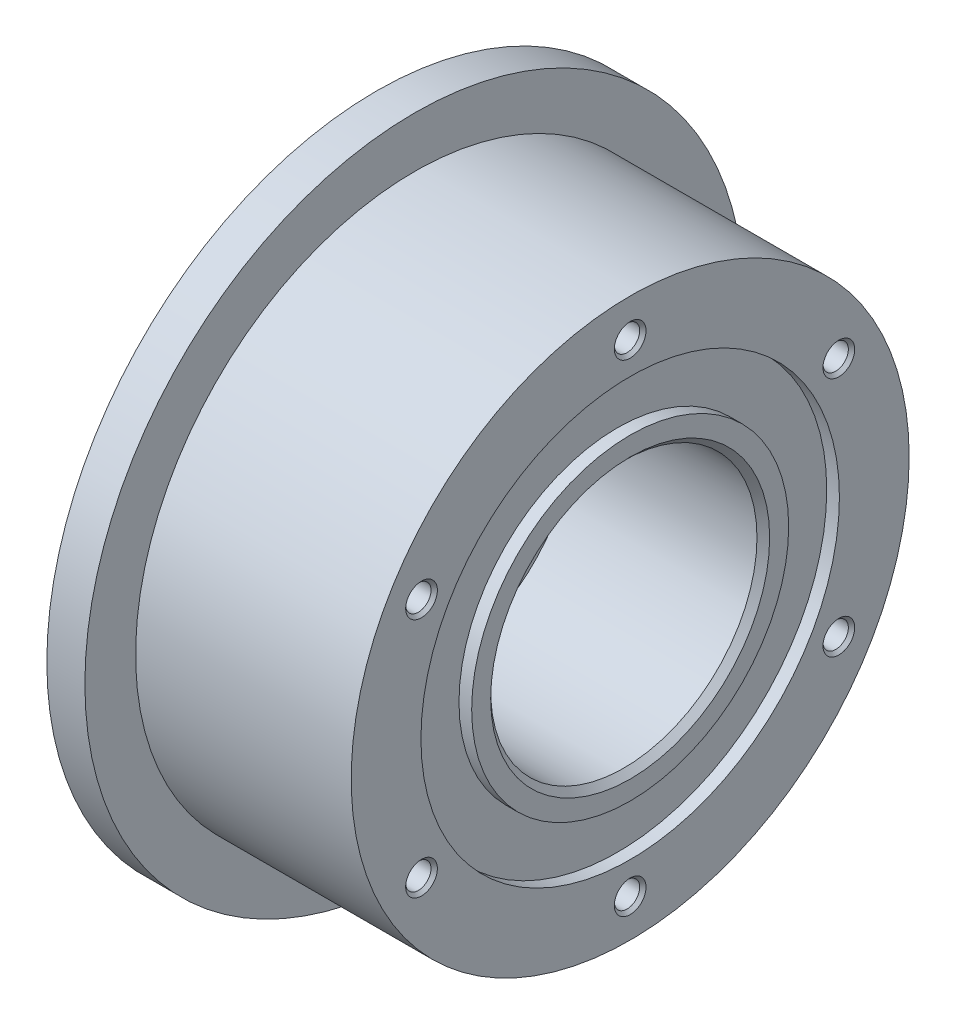
from build123d import *

# Parameters (mm, degrees)
HOLE_WIZARD_M561_D        = 66
HOLE_WIZARD_M561_DEPTH    = 2
SKETCH_4_R                = 25
EXTRUDE_1_DEPTH           = 2
HOLE_WIZARD_4_0_4_1_D     = 4
HOLE_WIZARD_4_0_4_1_DEPTH = 10
HOLE_WIZARD_4_0_4_2_D     = 4
HOLE_WIZARD_4_0_4_2_DEPTH = 10
CHAMFER_1_SIZE            = 1
CHAMFER_2_SIZE            = 0.5


with BuildPart() as part:
    # Эскиз1 → Повернуть1 (revolve)
    with BuildSketch(Plane.XY, mode=Mode.PRIVATE) as revolve_1_sk:
        with BuildLine():
            Line((-2, 31), (-2, 0))
            Line((-2, 0), (35, 0))
            Line((35, 0), (35, 44))
            Line((35, 44), (1, 44))
            Line((1, 44), (1, 52))
            Line((1, 52), (-5, 52))
            Line((-5, 52), (-5, 38))
            Line((-5, 38), (15.5, 38))
            ThreePointArc((15.5, 38), (19, 34.5), (15.5, 31))
            Line((15.5, 31), (-2, 31))
        make_face()
    revolve(revolve_1_sk.sketch.rotate(Axis((-5, 0, 0), (1, 0, 0)), 270), axis=Axis((-5, 0, 0), (1, 0, 0)))

    # Отверстие с зазором M561
    with Locations(Plane(origin=(35, 0, 0), x_dir=(0, 0, -1), z_dir=(1, 0, 0))):
        with Locations((0, 0)):
            Hole(HOLE_WIZARD_M561_D / 2, depth=HOLE_WIZARD_M561_DEPTH)

    # Эскиз4 → Бобышка-Вытянуть1 (add)
    with BuildSketch(Plane(origin=(33, 0, 0), x_dir=(0, 0, -1), z_dir=(1, 0, 0))):
        with Locations(Location((0, 0, 0), (0, 0, 180))):
            Circle(SKETCH_4_R)
    extrude(amount=EXTRUDE_1_DEPTH)

    # Эскиз5 → Вырез-Повернуть1 (revolve, cut)
    with BuildSketch(Plane.XY, mode=Mode.PRIVATE) as cut_revolve_1_sk:
        Polygon((-2, 29), (-2, 0), (35, 0), (35, 21), (5, 21), (5, 18), (0, 18), (0, 29), align=None)
    revolve(cut_revolve_1_sk.sketch.rotate(Axis((-2, 0, 0), (1, 0, 0)), 270), axis=Axis((-2, 0, 0), (1, 0, 0)), mode=Mode.SUBTRACT)

    # Диаметр отверстия Ø4.0 (4)1
    with Locations(Plane(origin=(35, 0, 0), x_dir=(0, 0, -1), z_dir=(1, 0, 0))):
        with Locations((-32.908965344, -19), (0, 38), (32.908965344, 19), (32.908965344, -19), (0, -38), (-32.908965344, 19)):
            Hole(HOLE_WIZARD_4_0_4_1_D / 2, depth=HOLE_WIZARD_4_0_4_1_DEPTH)

    # Диаметр отверстия Ø4.0 (4)2
    with Locations(Plane.ZY):
        with Locations((20.784609691, 12), (-20.784609691, 12), (0, -24), (20.784609691, -12), (-20.784609691, -12), (0, 24)):
            Hole(HOLE_WIZARD_4_0_4_2_D / 2, depth=HOLE_WIZARD_4_0_4_2_DEPTH)

    # Фаска1
    chamfer_1_edges = [part.edges().sort_by_distance(p)[0] for p in [
        (35, 0, 21),
    ]]
    chamfer(chamfer_1_edges, length=CHAMFER_1_SIZE)

    # Фаска2
    chamfer_2_edges = [part.edges().sort_by_distance(p)[0] for p in [
        (35, 19, 30.908965344),
        (35, -38, -2),
        (35, -19, -34.908965344),
        (35, 19, -34.908965344),
        (35, 38, -2),
        (35, -19, 30.908965344),
        (0, 24, 2),
        (0, -12, -18.784609691),
        (0, -12, 22.784609691),
        (0, -24, 2),
        (0, 12, -18.784609691),
        (0, 12, 22.784609691),
    ]]
    chamfer(chamfer_2_edges, length=CHAMFER_2_SIZE)


solid = part.part
